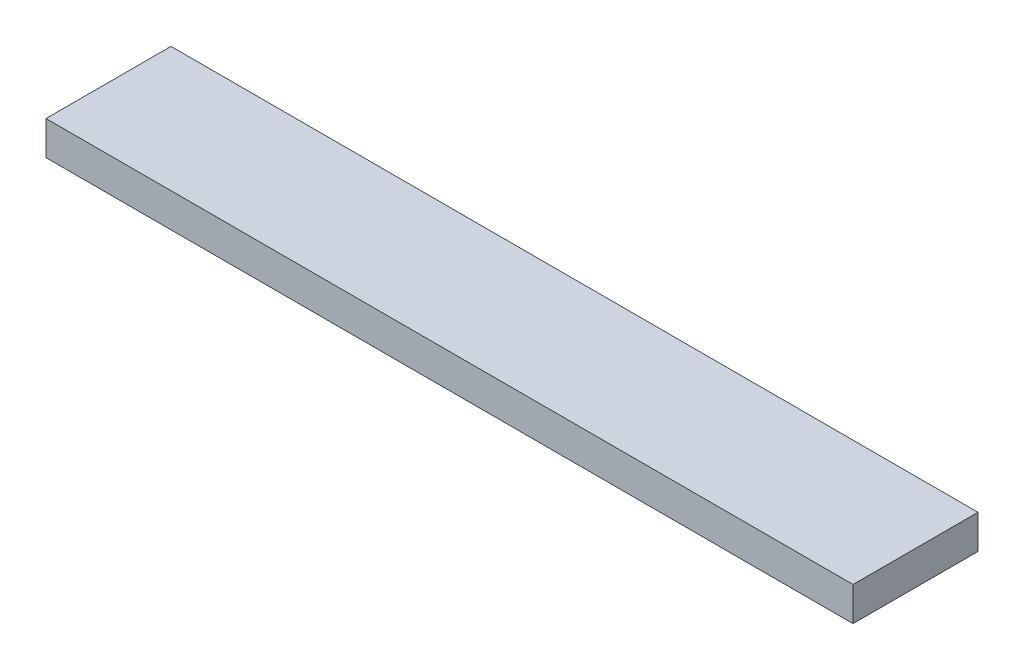
from build123d import *

# Parameters (mm, degrees)
SKETCH_1_W      = 226
SKETCH_1_H      = 35
EXTRUDE_1_DEPTH = 9.5


with BuildPart() as part:
    # 草图1 → 凸台-拉伸1 (new body)
    with BuildSketch(Plane(origin=(0, 0, 0), x_dir=(1, 0, 0), z_dir=(0, 1, 0))):
        with Locations((113, -17.5)):
            Rectangle(SKETCH_1_W, SKETCH_1_H)
    extrude(amount=EXTRUDE_1_DEPTH)


solid = part.part
